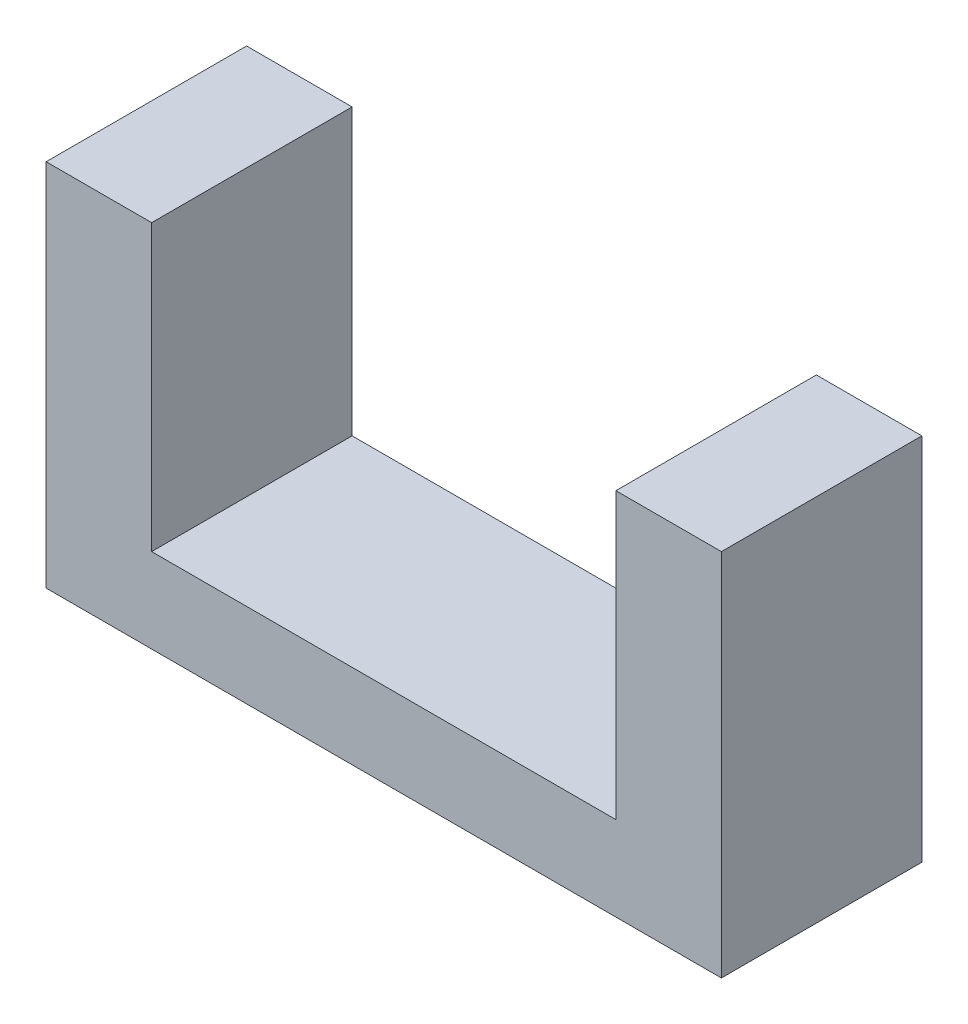
from build123d import *

# Parameters (mm, degrees)
SKETCH_1_W      = 32
SKETCH_1_H      = 9.5
EXTRUDE_1_DEPTH = 4
SKETCH_2_W      = 5
SKETCH_2_H      = 9.5
EXTRUDE_2_DEPTH = 13.5
SKETCH_3_W      = 5
SKETCH_3_H      = 9.5
EXTRUDE_3_DEPTH = 13.5


with BuildPart() as part:
    # 草图1 → 凸台-拉伸1 (new body)
    with BuildSketch(Plane(origin=(0, 0, 0), x_dir=(1, 0, 0), z_dir=(0, 1, 0))):
        with Locations((16, -4.75)):
            Rectangle(SKETCH_1_W, SKETCH_1_H)
    extrude(amount=EXTRUDE_1_DEPTH)

    # 草图2 → 凸台-拉伸2 (add)
    with BuildSketch(Plane(origin=(0, 4, 0), x_dir=(1, 0, 0), z_dir=(0, 1, 0))):
        with Locations((2.5, -4.75)):
            Rectangle(SKETCH_2_W, SKETCH_2_H)
    extrude(amount=EXTRUDE_2_DEPTH)

    # 草图3 → 凸台-拉伸3 (add)
    with BuildSketch(Plane(origin=(0, 4, 0), x_dir=(1, 0, 0), z_dir=(0, 1, 0))):
        with Locations((29.5, -4.75)):
            Rectangle(SKETCH_3_W, SKETCH_3_H)
    extrude(amount=EXTRUDE_3_DEPTH)


solid = part.part
